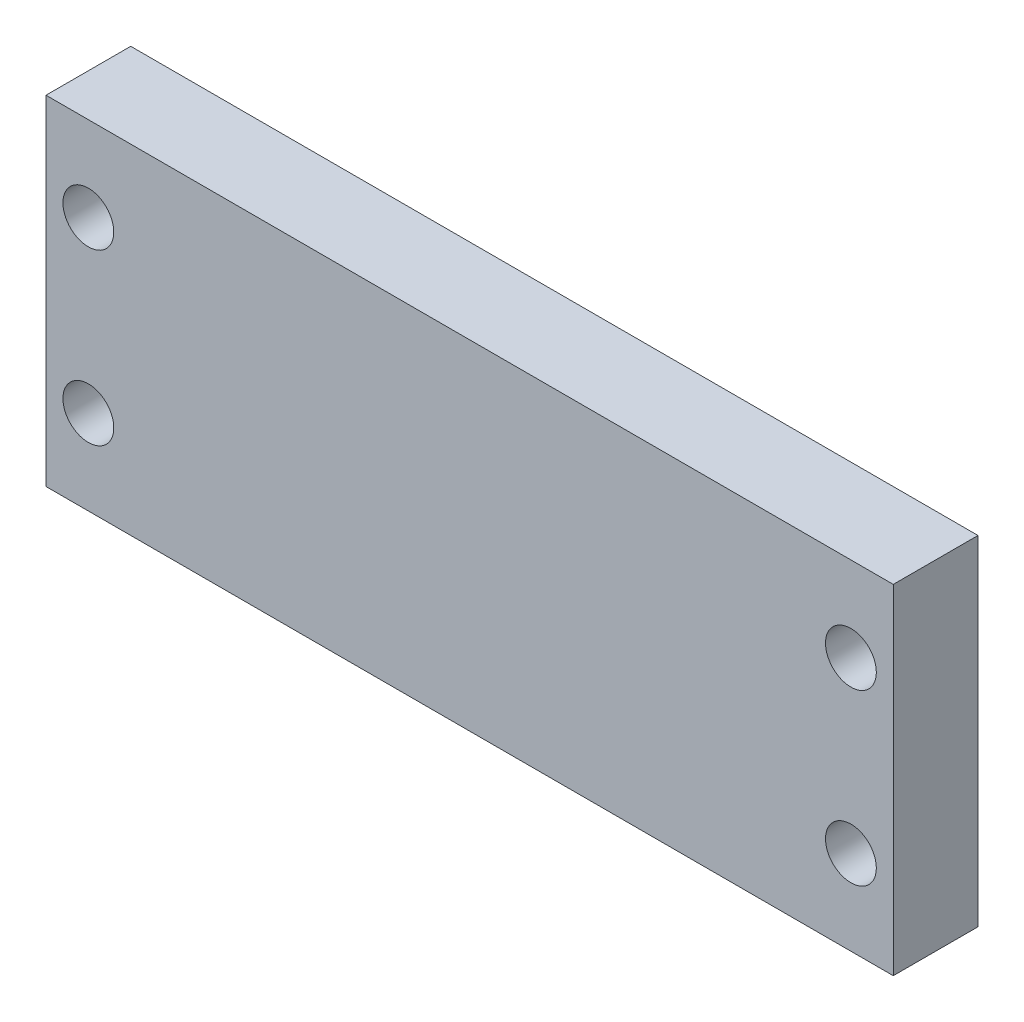
from build123d import *

# Parameters (mm, degrees)
SKETCH1_W           = 25
SKETCH1_H           = 20
SKETCH1_R           = 1.5
BOSS_EXTRUDE1_DEPTH = 5


with BuildPart() as part:
    # Sketch1 → Boss-Extrude1 (new body)
    with BuildSketch(Plane.XY):
        with Locations((12.5, 10)):
            Rectangle(SKETCH1_W, SKETCH1_H)
        with Locations((22.5, 5)):
            Circle(SKETCH1_R, mode=Mode.SUBTRACT)
        with Locations((22.5, 15)):
            Circle(SKETCH1_R, mode=Mode.SUBTRACT)
    boss_extrude1 = extrude(amount=BOSS_EXTRUDE1_DEPTH)

    # Mirror1: Boss-Extrude1 across plane
    add(boss_extrude1.mirror(Plane(origin=(0, 0, 5), x_dir=(0, 0, 1), z_dir=(1, 0, 0))))


solid = part.part
